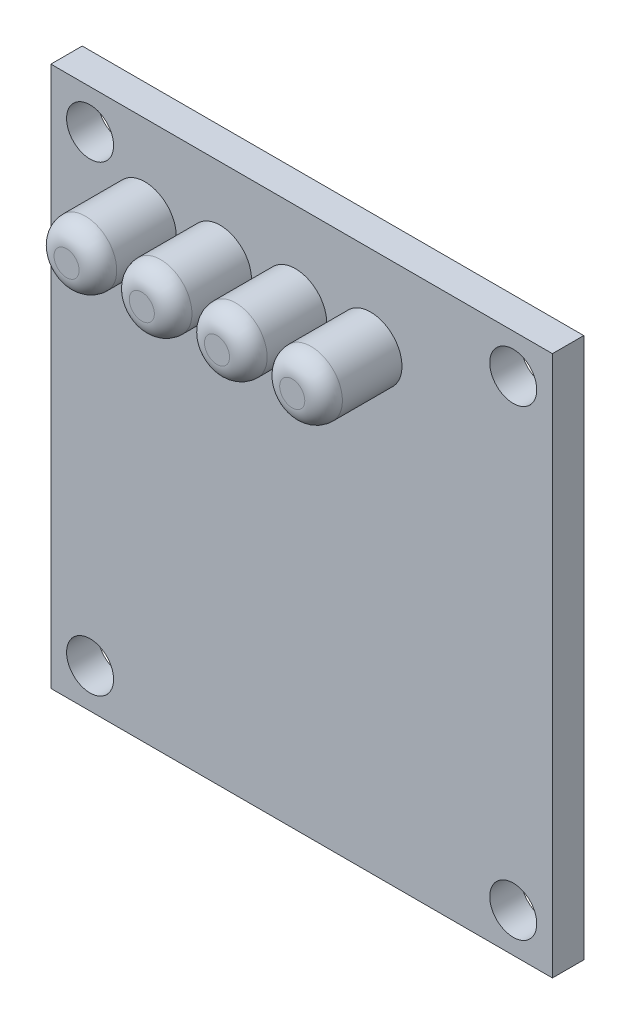
from build123d import *

# Parameters (mm, degrees)
SKETCH1_W           = 32
SKETCH1_H           = 34.5
SKETCH1_R           = 1.5
BOSS_EXTRUDE1_DEPTH = 2
SKETCH2_R           = 2
BOSS_EXTRUDE2_DEPTH = 5
FILLET1_R           = 1.2


with BuildPart() as part:
    # Sketch1 → Boss-Extrude1 (new body)
    with BuildSketch(Plane.XY):
        Rectangle(SKETCH1_W, SKETCH1_H)
        with Locations((-13.5, 14.75)):
            Circle(SKETCH1_R, mode=Mode.SUBTRACT)
        with Locations((13.5, 14.75)):
            Circle(SKETCH1_R, mode=Mode.SUBTRACT)
        with Locations((-13.5, -14.75)):
            Circle(SKETCH1_R, mode=Mode.SUBTRACT)
        with Locations((13.5, -14.75)):
            Circle(SKETCH1_R, mode=Mode.SUBTRACT)
    extrude(amount=BOSS_EXTRUDE1_DEPTH)

    # Sketch2 → Boss-Extrude2 (add)
    with BuildSketch(Plane.XY.offset(2)):
        with Locations((-10, 11.75)):
            Circle(SKETCH2_R)
        with Locations((-5.2, 11.75)):
            Circle(SKETCH2_R)
        with Locations((-0.4, 11.75)):
            Circle(SKETCH2_R)
        with Locations((4.4, 11.75)):
            Circle(SKETCH2_R)
    extrude(amount=BOSS_EXTRUDE2_DEPTH)

    # Fillet1
    fillet1_edges = [part.edges().sort_by_distance(p)[0] for p in [
        (-12, 11.75, 7),
        (-7.2, 11.75, 7),
        (-2.4, 11.75, 7),
        (2.4, 11.75, 7),
    ]]
    fillet(fillet1_edges, radius=FILLET1_R)


solid = part.part
